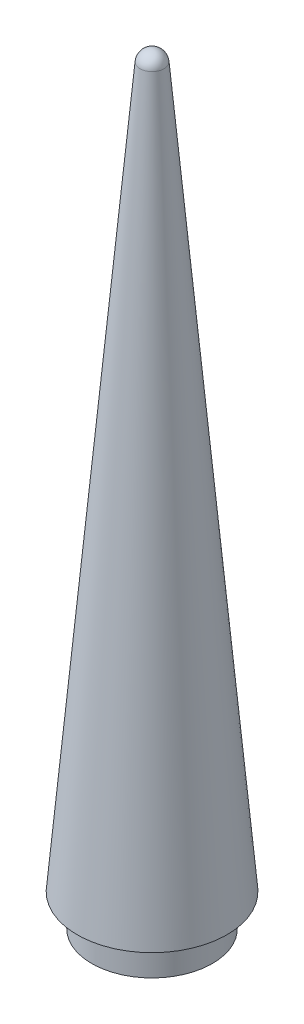
from build123d import *

# Parameters (mm, degrees)
F_1_4_20_TAPPED_HOLE1_D           = 5.1054
F_1_4_20_TAPPED_HOLE1_DEPTH       = 63.5
F_1_4_20_TAPPED_HOLE1_CSINK_D     = 7.62
F_1_4_20_TAPPED_HOLE1_CSINK_ANGLE = 90
F_1_4_20_TAPPED_HOLE1_TIP         = 1.533816902


with BuildPart() as part:
    # Sketch2 → Revolve1 (revolve)
    with BuildSketch(Plane.XY, mode=Mode.PRIVATE) as revolve1_sk:
        with BuildLine():
            Line((0, 121.620767237), (0, 6.473034307))
            Line((0, 6.473034307), (0, 1.393034307))
            Line((0, 1.393034307), (9.525, 1.393034307))
            Line((9.525, 1.393034307), (9.525, 6.473034307))
            Line((9.525, 6.473034307), (11.819732149, 6.473034307))
            Line((11.819732149, 6.473034307), (1.8977509, 119.881798927))
            ThreePointArc((1.8977509, 119.881798927), (1.286999346, 121.120280564), (0, 121.620767237))
        make_face()
    revolve(revolve1_sk.sketch.rotate(Axis((0, 6.473034307, 0), (0, 1, 0)), 90), axis=Axis((0, 6.473034307, 0), (0, 1, 0)))

    # 1/4-20 Tapped Hole1
    with Locations(Plane.XZ.offset(-1.393034307)):
        with Locations((0, 0)):
            CounterSinkHole(F_1_4_20_TAPPED_HOLE1_D / 2, F_1_4_20_TAPPED_HOLE1_CSINK_D / 2, depth=F_1_4_20_TAPPED_HOLE1_DEPTH, counter_sink_angle=F_1_4_20_TAPPED_HOLE1_CSINK_ANGLE)
            with Locations((0, 0, -(F_1_4_20_TAPPED_HOLE1_DEPTH + F_1_4_20_TAPPED_HOLE1_TIP / 2))):  # 118° drill point
                Cone(0, F_1_4_20_TAPPED_HOLE1_D / 2, F_1_4_20_TAPPED_HOLE1_TIP, mode=Mode.SUBTRACT)


solid = part.part
